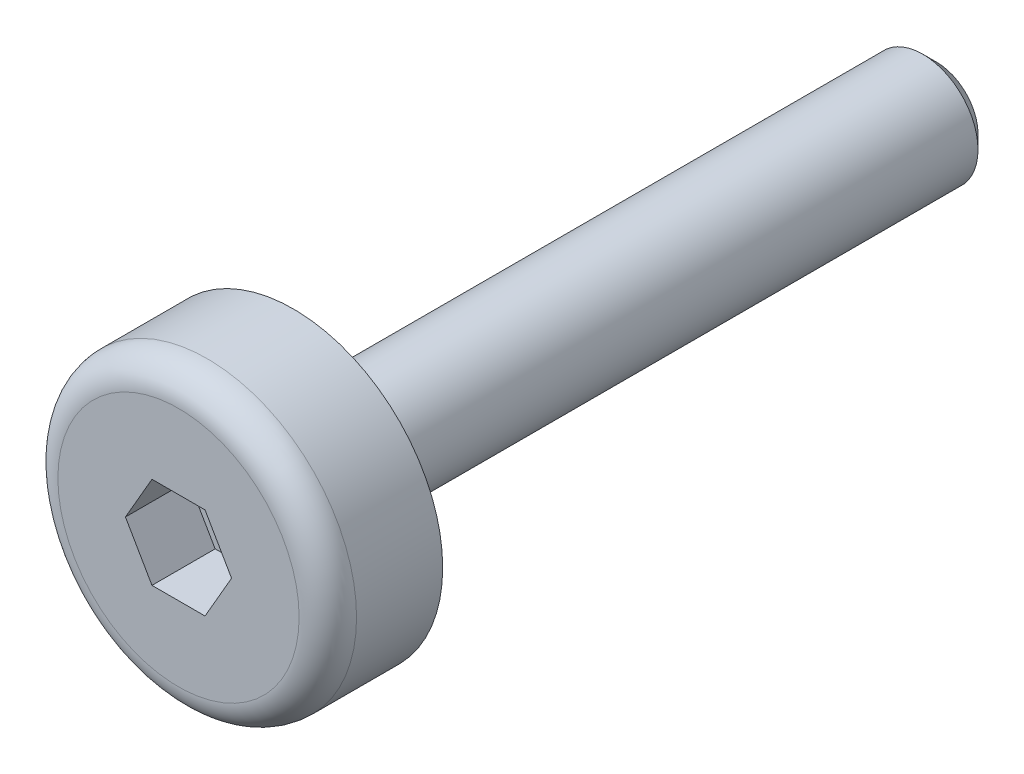
from build123d import *

# Parameters (mm, degrees)
SHANK_TIP_CHAMFER_SIZE = 0.3
PAN_HEAD_ROUND_R       = 0.625
HEX_DRIVE_CUT_DEPTH    = 1.375


with BuildPart() as part:
    # Screw Section → Screw Blank Revolve (revolve)
    with BuildSketch(Plane(origin=(0, 0, 0), x_dir=(1, 0, 0), z_dir=(0, 1, 0))):
        Polygon((0, 14), (1.2, 14), (1.2, 0), (3.25, 0), (3.25, -2.5), (0, -2.5), align=None)
    revolve(axis=Axis((0, 0, 10.123), (0, 0, -1)))

    # Shank Tip Chamfer
    shank_tip_chamfer_edges = [part.edges().sort_by_distance(p)[0] for p in [
        (-1.2, 0, -14),
    ]]
    chamfer(shank_tip_chamfer_edges, length=SHANK_TIP_CHAMFER_SIZE)

    # Pan Head Round
    pan_head_round_edges = [part.edges().sort_by_distance(p)[0] for p in [
        (-3.25, 0, 2.5),
    ]]
    fillet(pan_head_round_edges, radius=PAN_HEAD_ROUND_R)

    # Hex Drive Sketch → Hex Drive Cut (cut)
    with BuildSketch(Plane.XY.offset(2.5)):
        Polygon((1.154700538, 0), (0.577350269, 1), (-0.577350269, 1), (-1.154700538, 0), (-0.577350269, -1), (0.577350269, -1), align=None)
    extrude(amount=-HEX_DRIVE_CUT_DEPTH, mode=Mode.SUBTRACT)


solid = part.part
